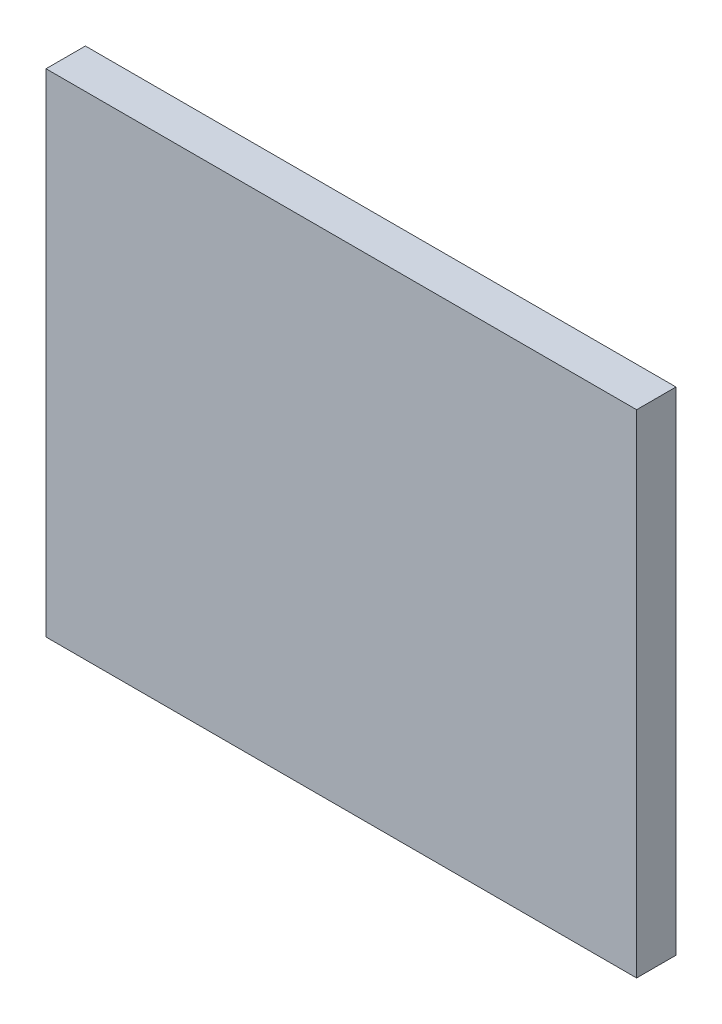
from build123d import *

# Parameters (mm, degrees)
SKETCH1_W           = 300
SKETCH1_H           = 250
BOSS_EXTRUDE1_DEPTH = 20


with BuildPart() as part:
    # Sketch1 → Boss-Extrude1 (new body)
    with BuildSketch(Plane.XY):
        Rectangle(SKETCH1_W, SKETCH1_H)
    extrude(amount=BOSS_EXTRUDE1_DEPTH)


solid = part.part
